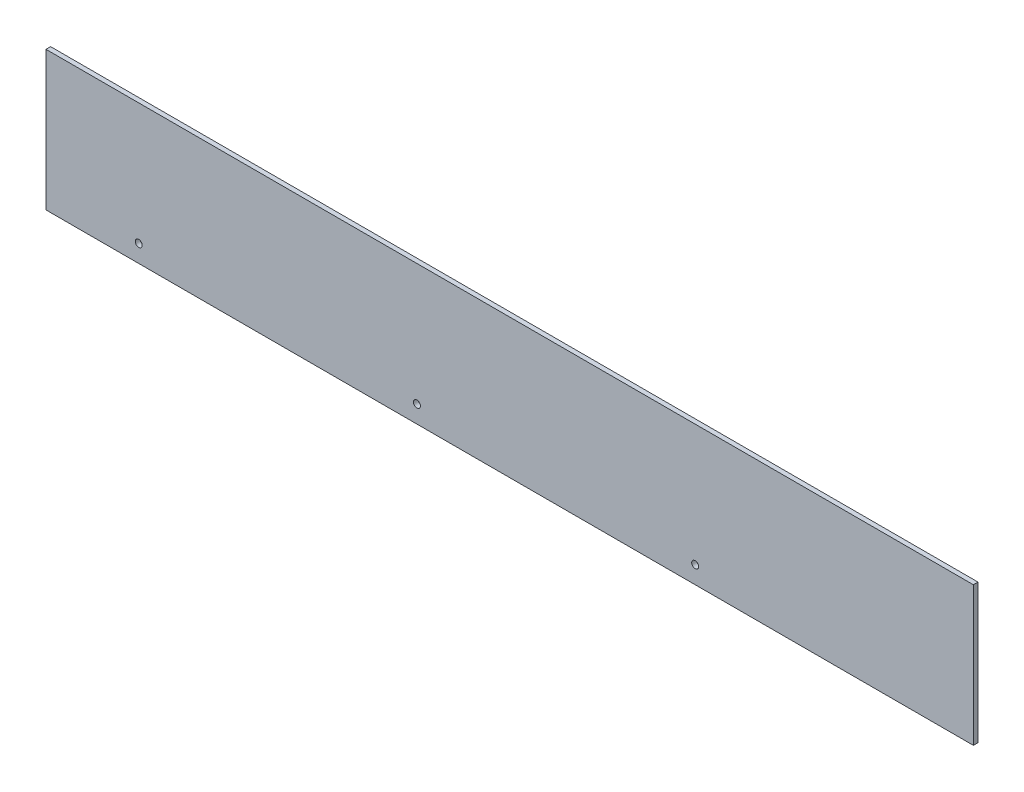
from build123d import *

# Parameters (mm, degrees)
SKETCH_1_W          = 400
SKETCH_1_H          = 60
EXTRUDE_1_DEPTH     = 2
SKETCH_2_R          = 1.5
CUT_EXTRUDE_1_DEPTH = 203.247373283


with BuildPart() as part:
    # 草图1 → 凸台-拉伸1 (new body)
    with BuildSketch(Plane.XY):
        Rectangle(SKETCH_1_W, SKETCH_1_H)
    extrude(amount=EXTRUDE_1_DEPTH)

    # 草图2 → 切除-拉伸1 (cut, through all)
    with BuildSketch(Plane.XY.offset(2)):
        with Locations((-160, -22.5)):
            Circle(SKETCH_2_R)
        with Locations((-40, -22.5)):
            Circle(SKETCH_2_R)
        with Locations((80, -22.5)):
            Circle(SKETCH_2_R)
    extrude(amount=-CUT_EXTRUDE_1_DEPTH, mode=Mode.SUBTRACT)


solid = part.part
